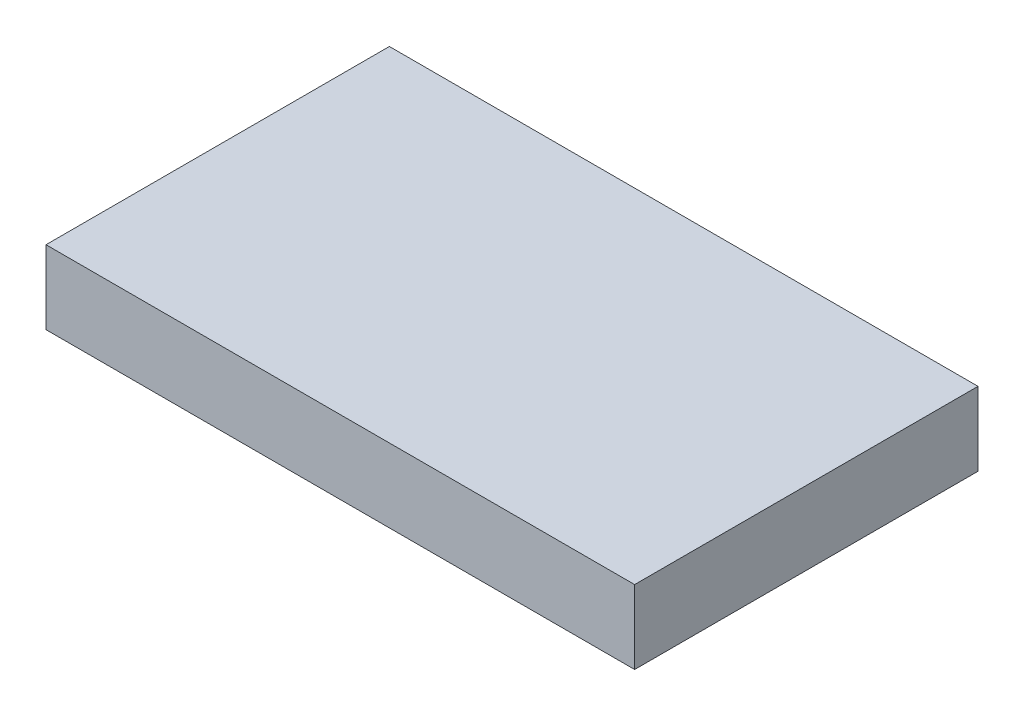
from build123d import *

# Parameters (mm, degrees)
SKETCH1_W           = 60.96
SKETCH1_H           = 35.56
BOSS_EXTRUDE1_DEPTH = 7.62


with BuildPart() as part:
    # Sketch1 → Boss-Extrude1 (new body)
    with BuildSketch(Plane(origin=(0, 0, 0), x_dir=(1, 0, 0), z_dir=(0, 1, 0))):
        with Locations((1.399368723, 0.069239598)):
            Rectangle(SKETCH1_W, SKETCH1_H)
    extrude(amount=BOSS_EXTRUDE1_DEPTH)


solid = part.part
